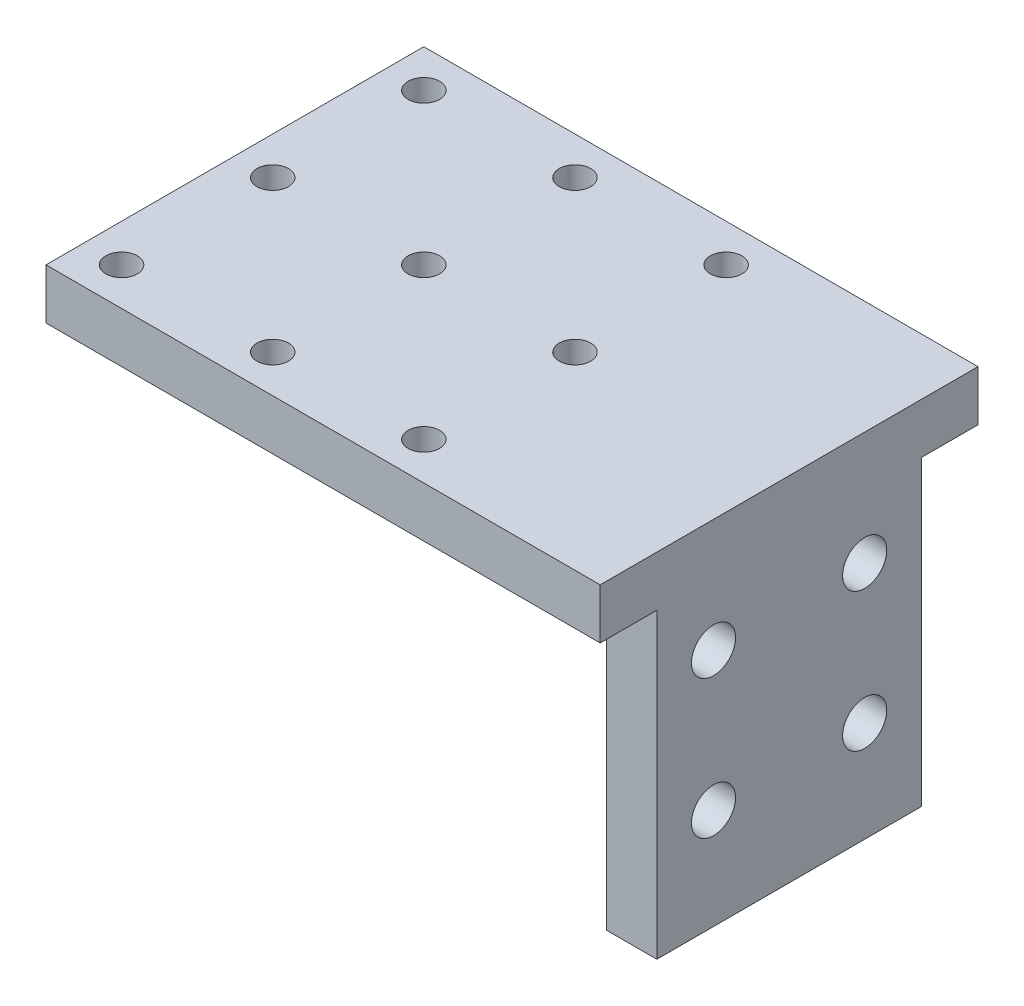
from build123d import *

# Parameters (mm, degrees)
EXTRUDE_1_DEPTH      = 30
SKETCH_2_R           = 1.25
CUT_EXTRUDE_1_DEPTH  = 58.306195128
SKETCH_4_W           = 4
SKETCH_4_H           = 24
CUT_EXTRUDE_2_DEPTH  = 4.5
SKETCH_5_R           = 1.75
CUT_EXTRUDE_3_DEPTH  = 61.166435826
EXTRUDE_2_DEPTH      = 2
EXTRUDE_2_DEPTH_BACK = 2


with BuildPart() as part:
    # Эскиз1 → Бобышка-Вытянуть1 (new body)
    with BuildSketch(Plane.XY):
        Polygon((0, 0), (0, 24), (-40, 24), (-40, 28), (4, 28), (4, 0), align=None)
    extrude(amount=-EXTRUDE_1_DEPTH)

    # Эскиз2 → Вырез-Вытянуть1 (cut, through all)
    with BuildSketch(Plane(origin=(0, 28, 0), x_dir=(1, 0, 0), z_dir=(0, 1, 0))):
        with Locations(Location((-37, 3, 0), (0, 0, 270))):
            Circle(SKETCH_2_R)
        with Locations(Location((-13, 3, 0), (0, 0, 270))):
            Circle(SKETCH_2_R)
        with Locations(Location((-37, 27, 0), (0, 0, 270))):
            Circle(SKETCH_2_R)
        with Locations(Location((-37, 15, 0), (0, 0, 270))):
            Circle(SKETCH_2_R)
        with Locations(Location((-25, 27, 0), (0, 0, 270))):
            Circle(SKETCH_2_R)
        with Locations(Location((-13, 27, 0), (0, 0, 270))):
            Circle(SKETCH_2_R)
        with Locations(Location((-13, 15, 0), (0, 0, 270))):
            Circle(SKETCH_2_R)
        with Locations(Location((-25, 3, 0), (0, 0, 270))):
            Circle(SKETCH_2_R)
        with Locations(Location((-25, 15, 0), (0, 0, 270))):
            Circle(SKETCH_2_R)
    extrude(amount=-CUT_EXTRUDE_1_DEPTH, mode=Mode.SUBTRACT)

    # Эскиз4 → Вырез-Вытянуть2 (cut)
    with BuildSketch(Plane.XY):
        with Locations((2, 12)):
            Rectangle(SKETCH_4_W, SKETCH_4_H)
    cut_extrude_2 = extrude(amount=-CUT_EXTRUDE_2_DEPTH, mode=Mode.SUBTRACT)

    # Зеркальное отражение1: Вырез-Вытянуть2 across plane
    add(cut_extrude_2.mirror(Plane.XY.offset(-15)), mode=Mode.SUBTRACT)

    # Эскиз5 → Вырез-Вытянуть3 (cut, through all)
    with BuildSketch(Plane(origin=(4, 0, 0), x_dir=(0, 0, -1), z_dir=(1, 0, 0))):
        with Locations(Location((9, 19, 0), (0, 0, 90))):
            Circle(SKETCH_5_R)
        with Locations(Location((21, 19, 0), (0, 0, 90))):
            Circle(SKETCH_5_R)
        with Locations(Location((21, 8, 0), (0, 0, 90))):
            Circle(SKETCH_5_R)
        with Locations(Location((9, 8, 0), (0, 0, 90))):
            Circle(SKETCH_5_R)
    extrude(amount=-CUT_EXTRUDE_3_DEPTH, mode=Mode.SUBTRACT)

    # Эскиз8 → Бобышка-Вытянуть2 (add, two sides: drawn at the far end of the back side and taken through both)
    with BuildSketch(Plane.XY.offset(-15).offset(-EXTRUDE_2_DEPTH_BACK)):
        Polygon((0, 0), (0, 24), (-8, 24), align=None)
    extrude(amount=EXTRUDE_2_DEPTH + EXTRUDE_2_DEPTH_BACK)


solid = part.part
